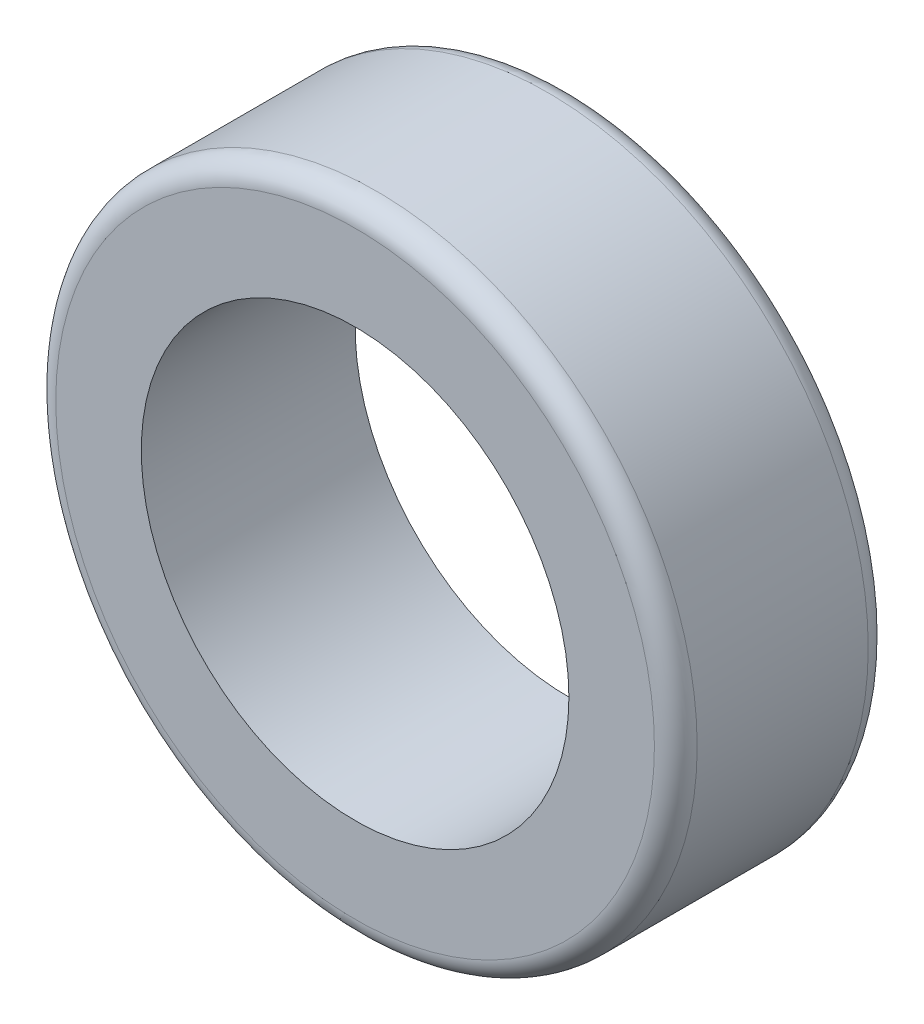
from build123d import *

# Parameters (mm, degrees)
SKETCH1_R           = 1.5
SKETCH1_R_2         = 1
BOSS_EXTRUDE1_DEPTH = 1
FILLET1_R           = 0.1


with BuildPart() as part:
    # Sketch1 → Boss-Extrude1 (new body)
    with BuildSketch(Plane.XY):
        Circle(SKETCH1_R)
        Circle(SKETCH1_R_2, mode=Mode.SUBTRACT)
    extrude(amount=BOSS_EXTRUDE1_DEPTH)

    # Fillet1
    fillet1_edges = [part.edges().sort_by_distance(p)[0] for p in [
        (-1.5, 0, 0),
        (-1.5, 0, 1),
    ]]
    fillet(fillet1_edges, radius=FILLET1_R)


solid = part.part
